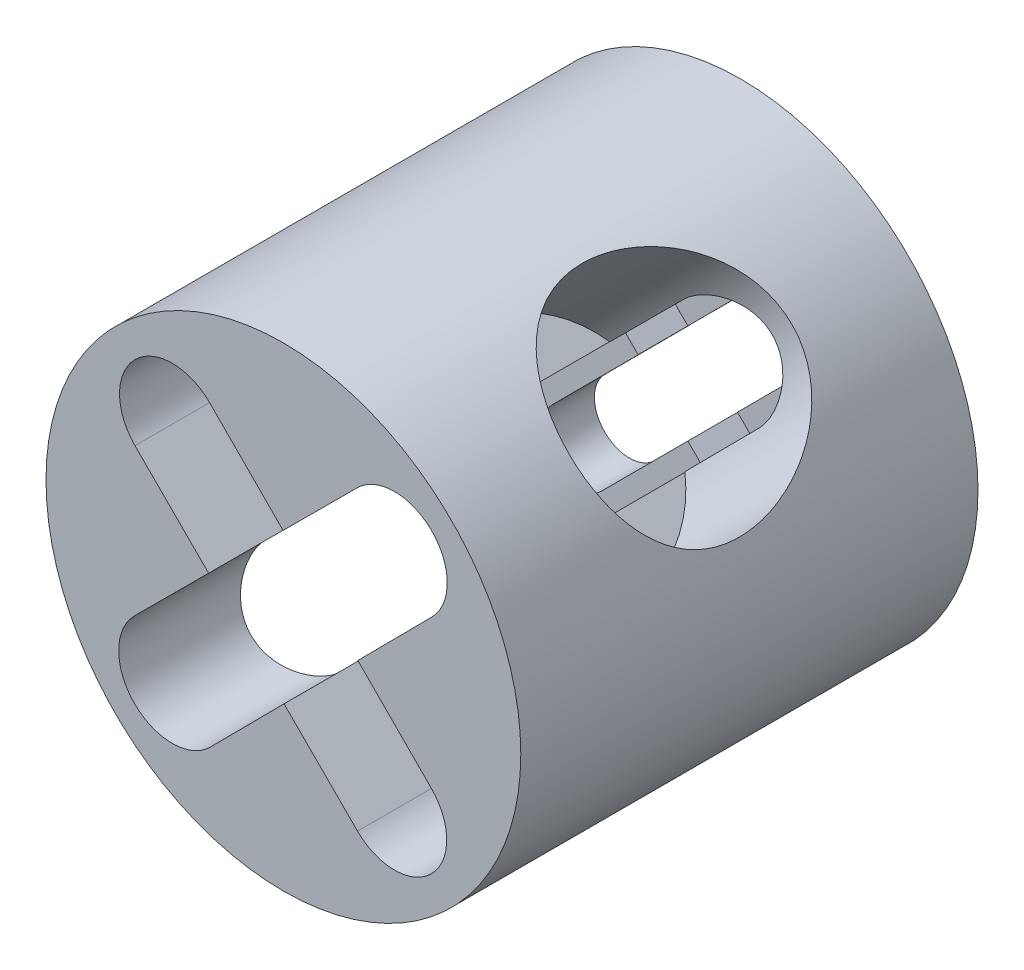
from build123d import *

# Parameters (mm, degrees)
SKETCH_1_R               = 13.5
EXTRUDE_1_DEPTH          = 3
SKETCH_2_R               = 13.5
EXTRUDE_3_DEPTH          = 23
CUT_EXTRUDE_1_DEPTH      = 23
CUT_EXTRUDE_1_DEPTH_BACK = 23
SKETCH_4_R               = 6.35


with BuildPart() as part:
    # 草图1 → 凸台-拉伸1 (new body)
    with BuildSketch(Plane.XY):
        Circle(SKETCH_1_R)
        with BuildLine():
            Line((0, -2.832983292), (-4.900787729, -7.749547196))
            ThreePointArc((-4.900787729, -7.749547196), (-7.729211202, -7.754092383), (-7.733756389, -4.92566891))
            Line((-7.733756389, -4.92566891), (-2.828423473, -0.004545187))
            ThreePointArc((-2.828423473, -0.004545187), (-2.828427125, 0), (-2.828423473, 0.004545187))
            Line((-2.828423473, 0.004545187), (-7.733756389, 4.92566891))
            ThreePointArc((-7.733756389, 4.92566891), (-7.729211202, 7.754092383), (-4.900787729, 7.749547196))
            Line((-4.900787729, 7.749547196), (0, 2.832983292))
            Line((0, 2.832983292), (4.900787729, 7.749547196))
            ThreePointArc((4.900787729, 7.749547196), (7.729211202, 7.754092383), (7.733756389, 4.92566891))
            Line((7.733756389, 4.92566891), (2.828423473, 0.004545187))
            ThreePointArc((2.828423473, 0.004545187), (2.828427125, 0), (2.828423473, -0.004545187))
            Line((2.828423473, -0.004545187), (7.733756389, -4.92566891))
            ThreePointArc((7.733756389, -4.92566891), (7.729211202, -7.754092383), (4.900787729, -7.749547196))
            Line((4.900787729, -7.749547196), (0, -2.832983292))
        make_face(mode=Mode.SUBTRACT)
    extrude(amount=EXTRUDE_1_DEPTH)

    # 草图2 → 凸台-拉伸3 (add)
    with BuildSketch(Plane.XY.offset(3)):
        Circle(SKETCH_2_R)
        with BuildLine():
            ThreePointArc((-8.438592403, 4.216287709), (-8.435180773, 8.462334548), (-4.189144899, 8.452099668))
            Line((-4.189144899, 8.452099668), (-0.01808109, 4.25413827))
            Line((-0.01808109, 4.25413827), (4.198281258, 8.461255384))
            ThreePointArc((4.198281258, 8.461255384), (8.435180773, 8.462334548), (8.447718707, 4.225453447))
            Line((8.447718707, 4.225453447), (4.233699653, -0.025060575))
            Line((4.233699653, -0.025060575), (8.424997972, -4.243386968))
            ThreePointArc((8.424997972, -4.243386968), (8.414877485, -8.441965901), (4.216287709, -8.438592403))
            Line((4.216287709, -8.438592403), (0.036402841, -4.258707534))
            Line((0.036402841, -4.258707534), (-4.152452764, -8.483840182))
            ThreePointArc((-4.152452764, -8.483840182), (-8.469351133, -8.496614906), (-8.470450678, -4.179697776))
            Line((-8.470450678, -4.179697776), (-4.251903786, 0.029599093))
            Line((-4.251903786, 0.029599093), (-8.438592403, 4.216287709))
        make_face(mode=Mode.SUBTRACT)
    extrude(amount=EXTRUDE_3_DEPTH)

    # 草图4 → 切除-拉伸1 (cut, two sides: drawn at the far end of the back side and taken through both)
    with BuildSketch(Plane(origin=(2.117926536, 2.10435635, 0), x_dir=(0, 0, 1), z_dir=(-0.7093757200092603, -0.7048305384000778, 0)).offset(-CUT_EXTRUDE_1_DEPTH_BACK)):
        with Locations((13, 0)):
            Circle(SKETCH_4_R)
    extrude(amount=CUT_EXTRUDE_1_DEPTH + CUT_EXTRUDE_1_DEPTH_BACK, mode=Mode.SUBTRACT)


solid = part.part
